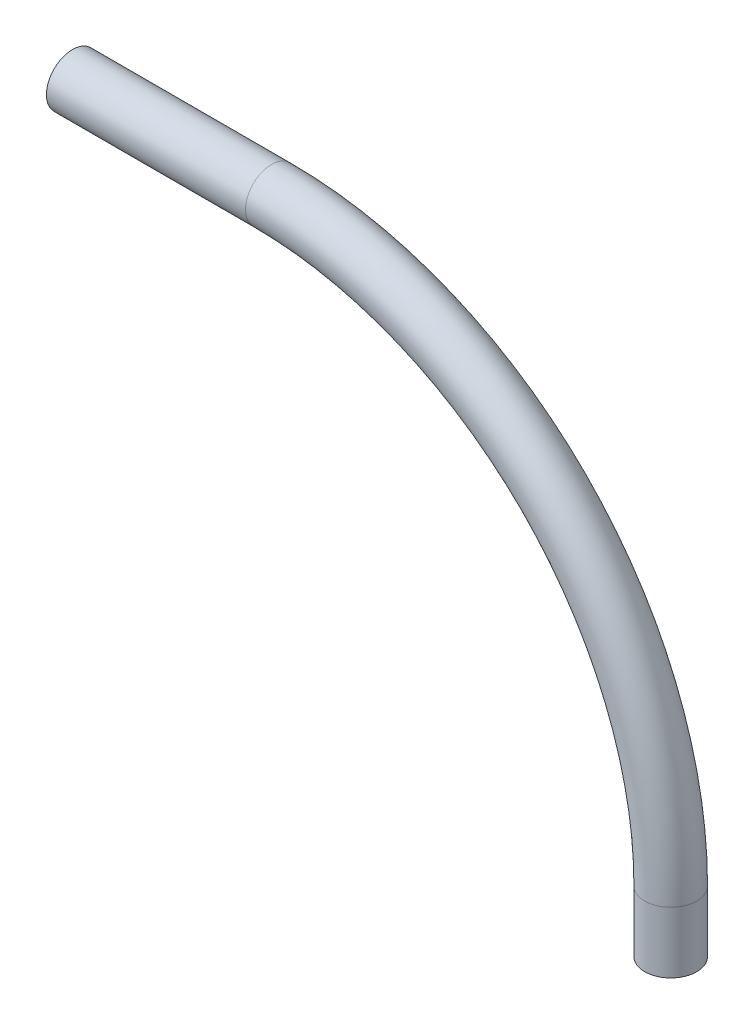
from build123d import *

# Parameters (mm, degrees)
SKETCH2_R   = 8.5
SKETCH2_R_2 = 4.85


with BuildPart() as part:
    # Sweep1: sweep along a curve in space
    with BuildLine() as sweep1_path:
        Line((-63.953291268, 176.442341084, 4.917581679), (1.046708732, 176.442341084, 4.917581679))
        ThreePointArc((1.046708732, 176.442341084, 4.917581679), (93.239290863, 138.254923215, 4.917581679), (131.426708732, 46.062341084, 4.917581679))
        Line((131.426708732, 26.062341084, 4.917581679), (131.426708732, 46.062341084, 4.917581679))
    # Sketch2 → Sweep1 (sweep)
    with BuildSketch(Plane(origin=(-63.953291268, 176.442341084, 4.917581679), x_dir=(0, 0, -1), z_dir=(1, 0, 0))):
        Circle(SKETCH2_R)
        Circle(SKETCH2_R_2, mode=Mode.SUBTRACT)
    sweep(path=sweep1_path.line)


solid = part.part
